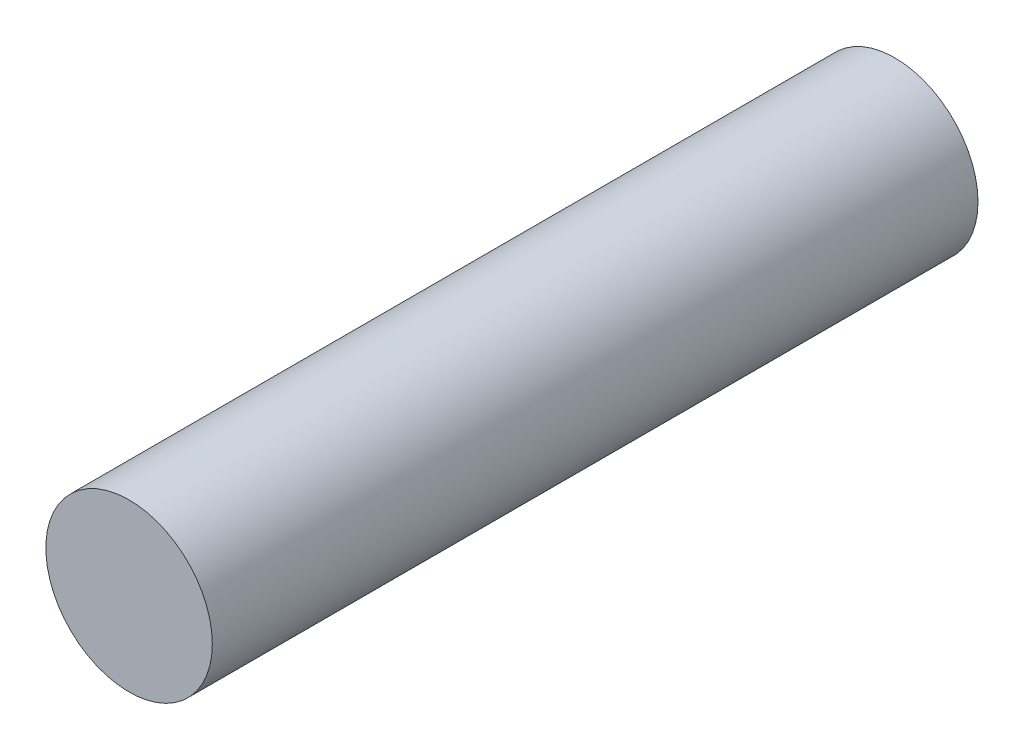
from build123d import *

# Parameters (mm, degrees)
ESQUISSE1_R        = 2.5
BOSS_EXTRU_1_DEPTH = 10
ESQUISSE2_R        = 2.5
BOSS_EXTRU_2_DEPTH = 13


with BuildPart() as part:
    # Esquisse1 → Boss.-Extru.1 (new body)
    with BuildSketch(Plane.XY):
        Circle(ESQUISSE1_R)
    extrude(amount=BOSS_EXTRU_1_DEPTH)

    # Esquisse2 → Boss.-Extru.2 (add)
    with BuildSketch(Plane.XY.offset(10)):
        Circle(ESQUISSE2_R)
    extrude(amount=BOSS_EXTRU_2_DEPTH)


solid = part.part
